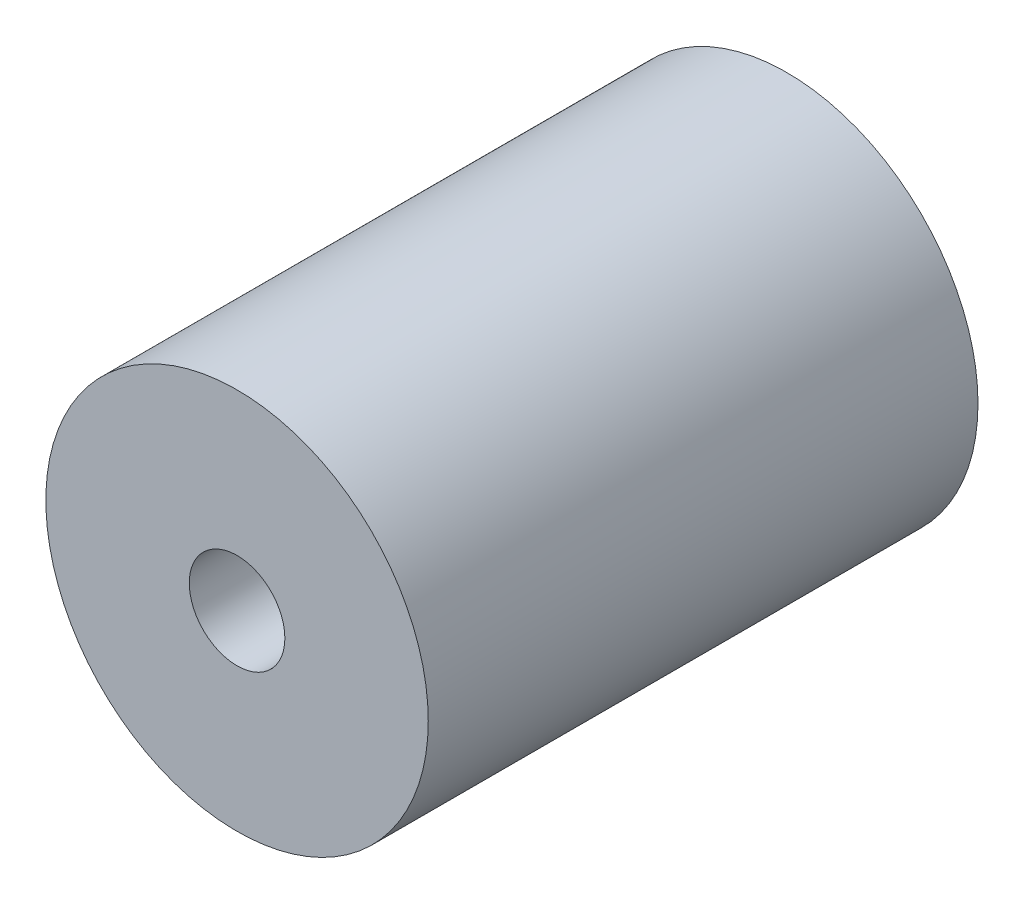
from build123d import *

# Parameters (mm, degrees)
SKETCH1_R           = 8
SKETCH1_R_2         = 2
BOSS_EXTRUDE1_DEPTH = 23


with BuildPart() as part:
    # Sketch1 → Boss-Extrude1 (new body)
    with BuildSketch(Plane.XY):
        Circle(SKETCH1_R)
        Circle(SKETCH1_R_2, mode=Mode.SUBTRACT)
    extrude(amount=BOSS_EXTRUDE1_DEPTH)


solid = part.part
